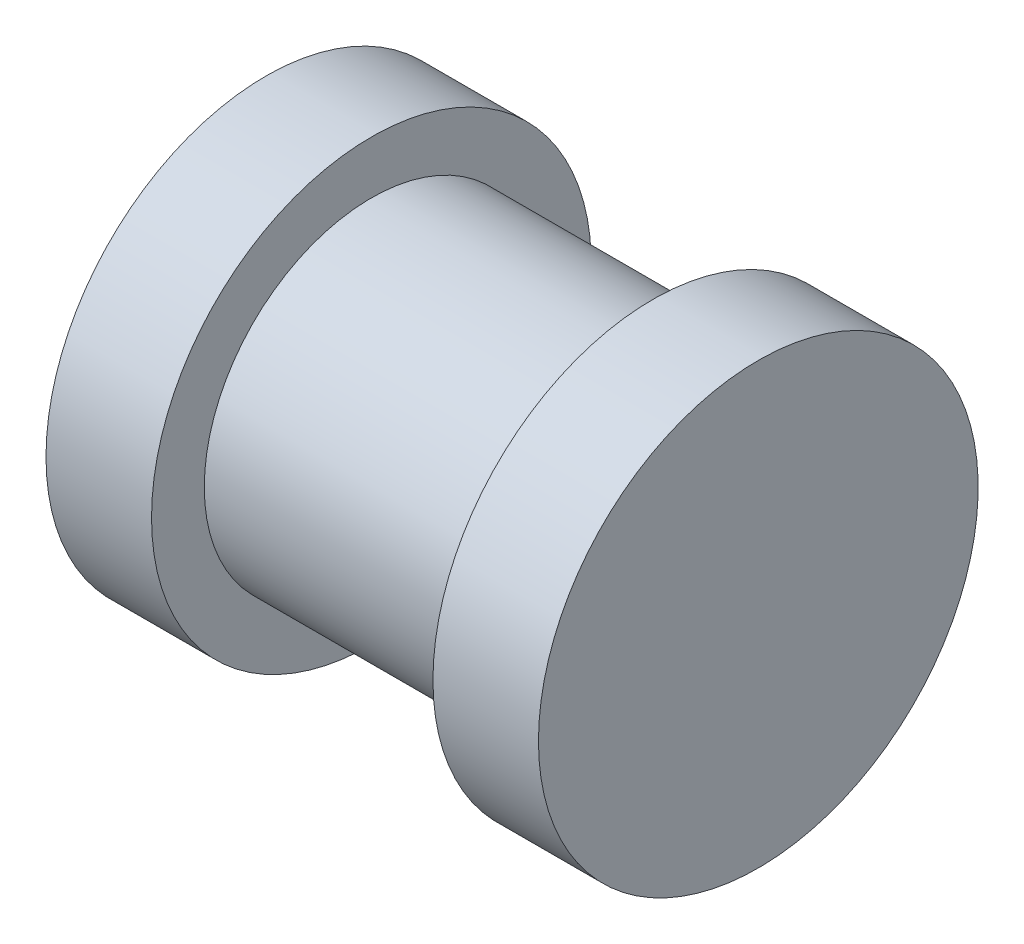
from build123d import *


with BuildPart() as part:
    # Sketch1 → Revolve1 (revolve)
    with BuildSketch(Plane.XY, mode=Mode.PRIVATE) as revolve1_sk:
        Polygon((14.224, 0), (14.224, 6.35), (11.176, 6.35), (11.176, 4.826), (3.048, 4.826), (3.048, 6.35), (0, 6.35), (0, 0), align=None)
    revolve(revolve1_sk.sketch.rotate(Axis((0, 0, 0), (1, 0, 0)), 90), axis=Axis((0, 0, 0), (1, 0, 0)))


solid = part.part
